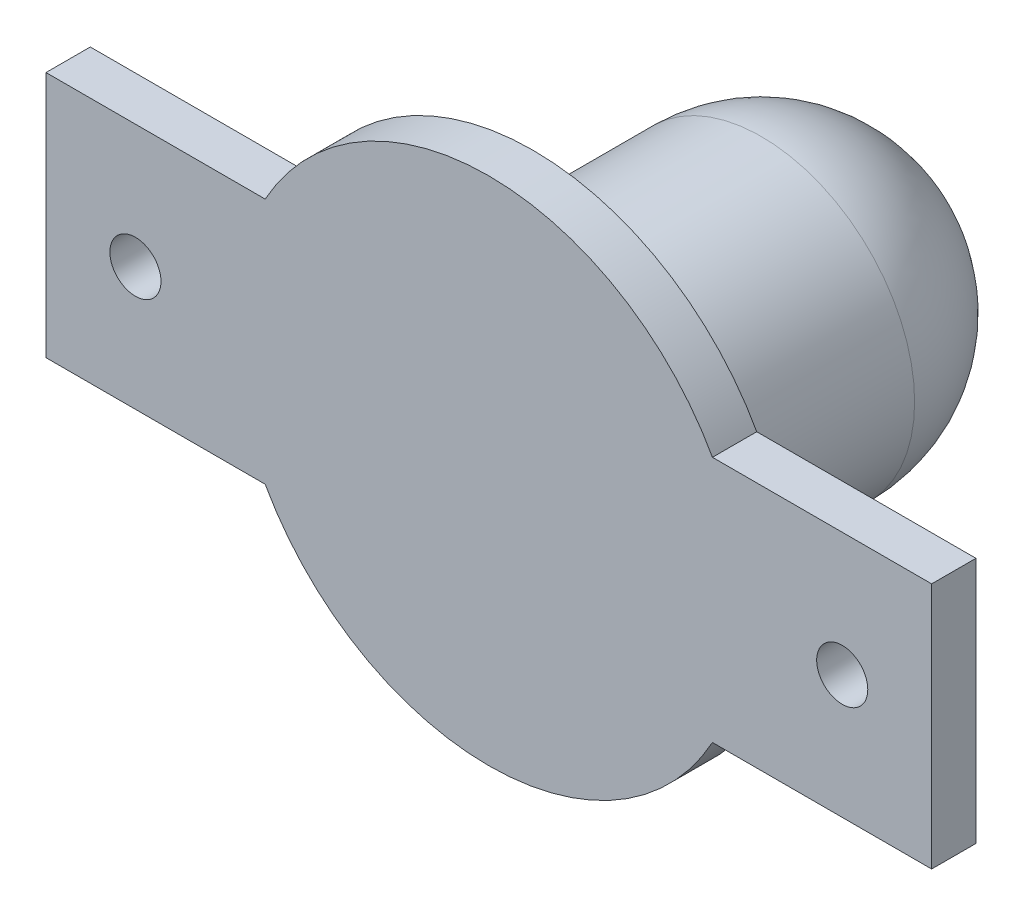
from build123d import *

# Parameters (mm, degrees)
BOSS_EXTRUDE2_DEPTH = 2.6
SKETCH2_R           = 9
BOSS_EXTRUDE3_DEPTH = 16
REVOLVE1_ANGLE      = 180
SKETCH5_R           = 1.5
CUT_EXTRUDE1_DEPTH  = 16


with BuildPart() as part:
    # Sketch1 → Boss-Extrude2 (new body)
    with BuildSketch(Plane.XY):
        with BuildLine():
            Line((-26, -7.25), (-26, 7.25))
            Line((-26, 7.25), (-13.13, 7.25))
            ThreePointArc((-13.13, 7.25), (0, 14.998646606), (13.13, 7.25))
            Line((13.13, 7.25), (26, 7.25))
            Line((26, 7.25), (26, -7.25))
            Line((26, -7.25), (13.13, -7.25))
            ThreePointArc((13.13, -7.25), (0, -14.998646606), (-13.13, -7.25))
            Line((-13.13, -7.25), (-26, -7.25))
        make_face()
    extrude(amount=-BOSS_EXTRUDE2_DEPTH)

    # Sketch2 → Boss-Extrude3 (add)
    with BuildSketch(Plane.XY):
        Circle(SKETCH2_R)
    extrude(amount=-BOSS_EXTRUDE3_DEPTH)

    # Sketch3 → Revolve1 (revolve)
    with BuildSketch(Plane(origin=(0, 0, -16), x_dir=(-1, 0, 0), z_dir=(0, 0, -1))):
        with BuildLine():
            Line((-9, 0), (9, 0))
            ThreePointArc((9, 0), (0, 9), (-9, 0))
        make_face()
    revolve(axis=Axis((9, 0, -16), (-1, 0, 0)), revolution_arc=REVOLVE1_ANGLE)

    # Sketch5 → Cut-Extrude1 (cut)
    with BuildSketch(Plane.XY):
        with Locations((-20.75, 0)):
            Circle(SKETCH5_R)
        with Locations((20.75, 0)):
            Circle(SKETCH5_R)
    extrude(amount=-CUT_EXTRUDE1_DEPTH, mode=Mode.SUBTRACT)


solid = part.part
